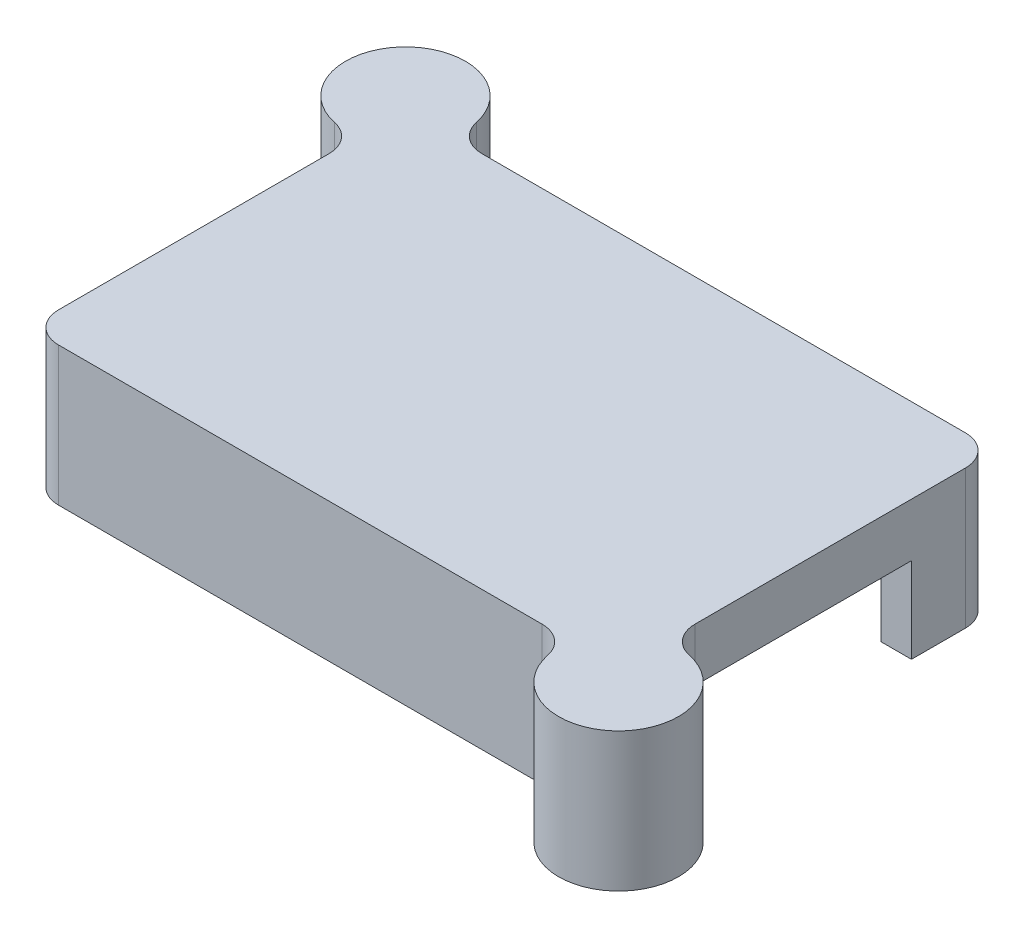
from build123d import *

# Parameters (mm, degrees)
SKETCH2_W                     = 49.3395
SKETCH2_H                     = 31.5341
SKETCH2_W_2                   = 44.2595
SKETCH2_H_2                   = 26.4541
BOSS_EXTRUDE1_DEPTH           = 1.905
SKETCH2_3_W                   = 49.3395
SKETCH2_3_H                   = 31.5341
SKETCH2_3_W_2                 = 44.2595
SKETCH2_3_H_2                 = 26.4541
BOSS_EXTRUDE2_DEPTH           = 9.6901
BOSS_EXTRUDE4_DEPTH           = 11.5951
CUT_EXTRUDE1_DEPTH            = 6.35
SKETCH6_R                     = 1.5
CUT_EXTRUDE2_DEPTH            = 3.429
SKETCH9_R                     = 1
BOSS_EXTRUDE6_DEPTH           = 2.794
BOSS_EXTRUDE6_DRAFT           = 2
BOSS_EXTRUDE6_PROFILE_2_DEPTH = 2.794
BOSS_EXTRUDE6_PROFILE_2_DRAFT = 2
SKETCH10_W                    = 17.4244
SKETCH10_H                    = 7.142607
CUT_EXTRUDE3_DEPTH            = 2.54
SKETCH11_W                    = 18.161
SKETCH11_H                    = 7.142607
CUT_EXTRUDE4_DEPTH            = 2.54
FILLET1_R                     = 2.54
FILLET2_R                     = 1.27
FILLET3_R                     = 2.54


with BuildPart() as part:
    # Sketch2 → Boss-Extrude1 (new body)
    # profile 1 of 2: a face of its own
    with BuildSketch(Plane(origin=(-16.248832885, 1.905, 5.92599481), x_dir=(1, 0, 0), z_dir=(0, 1, 0))):
        Rectangle(SKETCH2_W, SKETCH2_H)
        Rectangle(SKETCH2_W_2, SKETCH2_H_2, mode=Mode.SUBTRACT)
    # profile 2 of 2: a face of its own
    with BuildSketch(Plane(origin=(-16.248832885, 1.905, 5.92599481), x_dir=(1, 0, 0), z_dir=(0, 1, 0))):
        Rectangle(SKETCH2_W_2, SKETCH2_H_2)
    extrude(amount=BOSS_EXTRUDE1_DEPTH)

    # Sketch2<3> → Boss-Extrude2 (add)
    with BuildSketch(Plane(origin=(-16.248832885, 1.905, 5.92599481), x_dir=(1, 0, 0), z_dir=(0, 1, 0))):
        Rectangle(SKETCH2_3_W, SKETCH2_3_H)
        Rectangle(SKETCH2_3_W_2, SKETCH2_3_H_2, mode=Mode.SUBTRACT)
    extrude(amount=-BOSS_EXTRUDE2_DEPTH)

    # Sketch4 → Boss-Extrude4 (add)
    with BuildSketch(Plane.XZ.offset(7.7851)):
        with BuildLine():
            Line((-40.918582885, -9.84105519), (-40.918582885, -8.642431999))
            ThreePointArc((-40.918582885, -8.642431999), (-43.945507331, -12.145771785), (-39.503803797, -10.839276102))
            ThreePointArc((-39.503803797, -10.839276102), (-39.558461814, -10.328598033), (-39.719959694, -9.84105519))
            Line((-39.719959694, -9.84105519), (-40.918582885, -9.84105519))
        make_face()
        with BuildLine():
            ThreePointArc((-39.719959694, -9.84105519), (-40.210555134, -9.133027439), (-40.918582885, -8.642431999))
            Line((-40.918582885, -8.642431999), (-40.918582885, -9.84105519))
            Line((-40.918582885, -9.84105519), (-39.719959694, -9.84105519))
        make_face()
        with BuildLine():
            Line((-40.918582885, -8.642431999), (-40.918582885, -5.936055787))
            ThreePointArc((-40.918582885, -5.936055787), (-45.791911037, -14.004960596), (-36.913003797, -10.839276102))
            ThreePointArc((-36.913003797, -10.839276102), (-36.938212217, -10.337638468), (-37.013583483, -9.84105519))
            Line((-37.013583483, -9.84105519), (-39.719959694, -9.84105519))
            ThreePointArc((-39.719959694, -9.84105519), (-39.558461814, -10.328598033), (-39.503803797, -10.839276102))
            ThreePointArc((-39.503803797, -10.839276102), (-43.945507331, -12.145771785), (-40.918582885, -8.642431999))
        make_face()
        with BuildLine():
            ThreePointArc((-37.013583483, -9.84105519), (-38.378582885, -7.30105519), (-40.918582885, -5.936055787))
            Line((-40.918582885, -5.936055787), (-40.918582885, -8.642431999))
            ThreePointArc((-40.918582885, -8.642431999), (-40.210555134, -9.133027439), (-39.719959694, -9.84105519))
            Line((-39.719959694, -9.84105519), (-37.013583483, -9.84105519))
        make_face()
        with BuildLine():
            Line((8.420917115, 21.69304481), (7.222293924, 21.69304481))
            ThreePointArc((7.222293924, 21.69304481), (7.712889363, 20.985017059), (8.420917115, 20.494421619))
            Line((8.420917115, 20.494421619), (8.420917115, 21.69304481))
        make_face()
        with BuildLine():
            ThreePointArc((11.832138026, 22.691265722), (8.908459957, 25.049607705), (7.222293924, 21.69304481))
            Line((7.222293924, 21.69304481), (8.420917115, 21.69304481))
            Line((8.420917115, 21.69304481), (8.420917115, 20.494421619))
            ThreePointArc((8.420917115, 20.494421619), (10.72563371, 20.662562188), (11.832138026, 22.691265722))
        make_face()
        with BuildLine():
            ThreePointArc((8.420917115, 17.788045407), (12.584822521, 18.816158482), (14.422938026, 22.691265722))
            ThreePointArc((14.422938026, 22.691265722), (8.917500393, 27.669857302), (4.515917712, 21.69304481))
            Line((4.515917712, 21.69304481), (7.222293924, 21.69304481))
            ThreePointArc((7.222293924, 21.69304481), (8.908459957, 25.049607705), (11.832138026, 22.691265722))
            ThreePointArc((11.832138026, 22.691265722), (10.72563371, 20.662562188), (8.420917115, 20.494421619))
            Line((8.420917115, 20.494421619), (8.420917115, 17.788045407))
        make_face()
        with BuildLine():
            Line((7.222293924, 21.69304481), (4.515917712, 21.69304481))
            ThreePointArc((4.515917712, 21.69304481), (5.880917115, 19.15304481), (8.420917115, 17.788045407))
            Line((8.420917115, 17.788045407), (8.420917115, 20.494421619))
            ThreePointArc((8.420917115, 20.494421619), (7.712889363, 20.985017059), (7.222293924, 21.69304481))
        make_face()
    extrude(amount=-BOSS_EXTRUDE4_DEPTH)

    # Sketch4<3> → Cut-Extrude1 (cut)
    with BuildSketch(Plane.XZ.offset(7.7851)):
        with BuildLine():
            Line((-40.918582885, -9.84105519), (-40.918582885, -8.642431999))
            ThreePointArc((-40.918582885, -8.642431999), (-43.945507331, -12.145771785), (-39.503803797, -10.839276102))
            ThreePointArc((-39.503803797, -10.839276102), (-39.558461814, -10.328598033), (-39.719959694, -9.84105519))
            Line((-39.719959694, -9.84105519), (-40.918582885, -9.84105519))
        make_face()
        with BuildLine():
            ThreePointArc((-39.719959694, -9.84105519), (-40.210555134, -9.133027439), (-40.918582885, -8.642431999))
            Line((-40.918582885, -8.642431999), (-40.918582885, -9.84105519))
            Line((-40.918582885, -9.84105519), (-39.719959694, -9.84105519))
        make_face()
        with BuildLine():
            Line((8.420917115, 21.69304481), (7.222293924, 21.69304481))
            ThreePointArc((7.222293924, 21.69304481), (7.712889363, 20.985017059), (8.420917115, 20.494421619))
            Line((8.420917115, 20.494421619), (8.420917115, 21.69304481))
        make_face()
        with BuildLine():
            ThreePointArc((11.832138026, 22.691265722), (8.908459957, 25.049607705), (7.222293924, 21.69304481))
            Line((7.222293924, 21.69304481), (8.420917115, 21.69304481))
            Line((8.420917115, 21.69304481), (8.420917115, 20.494421619))
            ThreePointArc((8.420917115, 20.494421619), (10.72563371, 20.662562188), (11.832138026, 22.691265722))
        make_face()
    extrude(amount=-CUT_EXTRUDE1_DEPTH, mode=Mode.SUBTRACT)

    # Sketch6 → Cut-Extrude2 (cut)
    with BuildSketch(Plane.XZ.offset(1.4351)):
        with Locations(Location((9.419138026, 22.691265722, 0), (0, 0, 270))):
            Circle(SKETCH6_R)
        with Locations(Location((-41.916803797, -10.839276102, 0), (0, 0, 270))):
            Circle(SKETCH6_R)
    extrude(amount=-CUT_EXTRUDE2_DEPTH, mode=Mode.SUBTRACT)

    # Sketch7 → Cut-Revolve1 (revolve, cut)
    with BuildSketch(Plane(origin=(0, 0, -10.839276102), x_dir=(0, -1, 0), z_dir=(0, 0, -1)), mode=Mode.PRIVATE) as cut_revolve1_sk:
        Polygon((1.4351, 43.597127469), (7.7851, 44.716803797), (7.7851, 41.916803797), (1.4351, 41.916803797), align=None)
    revolve(cut_revolve1_sk.sketch.rotate(Axis((-41.916803797, -7.7851, -10.839276102), (0, 1, 0)), 270), axis=Axis((-41.916803797, -7.7851, -10.839276102), (0, 1, 0)), mode=Mode.SUBTRACT)

    # Sketch8 → Cut-Revolve2 (revolve, cut)
    with BuildSketch(Plane(origin=(9.419138026, 0, 0), x_dir=(0, -1, 0), z_dir=(-1, 0, 0)), mode=Mode.PRIVATE) as cut_revolve2_sk:
        Polygon((1.4351, 24.371589394), (7.7851, 25.491265722), (7.7851, 22.691265722), (1.4351, 22.691265722), align=None)
    revolve(cut_revolve2_sk.sketch.rotate(Axis((9.419138026, -7.7851, 22.691265722), (0, 1, 0)), 180), axis=Axis((9.419138026, -7.7851, 22.691265722), (0, 1, 0)), mode=Mode.SUBTRACT)


with BuildPart() as boss_extrude6_tool:
    # Sketch9 → Boss-Extrude6 (with draft: the straight prism first)
    with BuildSketch(Plane.XZ.offset(-1.905)):
        with Locations((-35.108582885, 15.88304481)):
            Circle(SKETCH9_R)
    extrude(amount=BOSS_EXTRUDE6_DEPTH)
    # Boss-Extrude6: the draft: its side faces are tilted about the plane it starts from
    boss_extrude6_sides = [boss_extrude6_tool.faces().sort_by_distance(p)[0] for p in [
        (-36.108582885, 0.508, 15.88304481),
    ]]
    draft(boss_extrude6_sides, Plane.XZ.offset(-1.905), BOSS_EXTRUDE6_DRAFT)


with BuildPart() as part_1:
    add(part.part)

    # Boss-Extrude6: add boss_extrude6_tool
    add(boss_extrude6_tool.part)


with BuildPart() as boss_extrude6_profile_2_tool:
    # Sketch9 → Boss-Extrude6 profile 2 (with draft: the straight prism first)
    with BuildSketch(Plane.XZ.offset(-1.905)):
        with Locations((2.610917115, -4.03105519)):
            Circle(SKETCH9_R)
    extrude(amount=BOSS_EXTRUDE6_PROFILE_2_DEPTH)
    # Boss-Extrude6 profile 2: the draft: its side faces are tilted about the plane it starts from
    boss_extrude6_profile_2_sides = [boss_extrude6_profile_2_tool.faces().sort_by_distance(p)[0] for p in [
        (1.610917115, 0.508, -4.03105519),
    ]]
    draft(boss_extrude6_profile_2_sides, Plane.XZ.offset(-1.905), BOSS_EXTRUDE6_PROFILE_2_DRAFT)


with BuildPart() as part_2:
    add(part_1.part)

    # Boss-Extrude6 profile 2: add boss_extrude6_profile_2_tool
    add(boss_extrude6_profile_2_tool.part)

    # Sketch10 → Cut-Extrude3 (cut)
    with BuildSketch(Plane(origin=(8.420917115, 0, 0), x_dir=(0, 0, -1), z_dir=(1, 0, 0))):
        with Locations((-5.92599481, -4.2137965)):
            Rectangle(SKETCH10_W, SKETCH10_H)
    extrude(amount=-CUT_EXTRUDE3_DEPTH, mode=Mode.SUBTRACT)

    # Sketch11 → Cut-Extrude4 (cut)
    with BuildSketch(Plane.ZY.offset(40.918582885)):
        with Locations((5.92599481, -4.2137965)):
            Rectangle(SKETCH11_W, SKETCH11_H)
    extrude(amount=-CUT_EXTRUDE4_DEPTH, mode=Mode.SUBTRACT)

    # Fillet1
    fillet1_edges = [part_2.edges().sort_by_distance(p)[0] for p in [
        (-40.918582885, -1.98755, 21.69304481),
        (8.420917115, -1.98755, -9.84105519),
    ]]
    fillet(fillet1_edges, radius=FILLET1_R)

    # Fillet2
    fillet2_edges = [part_2.edges().sort_by_distance(p)[0] for p in [
        (-38.378582885, -2.94005, 19.15304481),
        (5.880917115, -2.94005, 19.15304481),
        (5.880917115, -2.94005, -7.30105519),
        (-38.378582885, -2.94005, -7.30105519),
    ]]
    fillet(fillet2_edges, radius=FILLET2_R)

    # Fillet3
    fillet3_edges = [part_2.edges().sort_by_distance(p)[0] for p in [
        (-37.013583483, -1.98755, -9.84105519),
        (-40.918582885, -1.98755, -5.936055787),
        (4.515917712, -1.98755, 21.69304481),
        (8.420917115, -1.98755, 17.788045407),
    ]]
    fillet(fillet3_edges, radius=FILLET3_R)


solid = part_2.part
